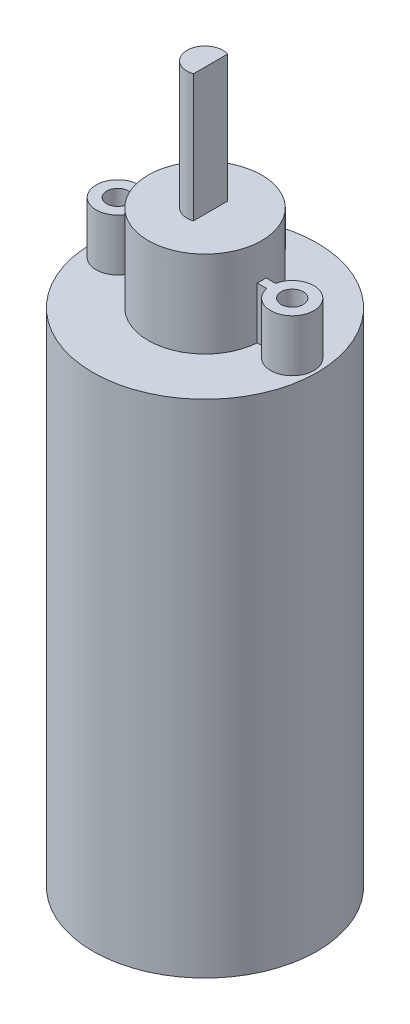
from build123d import *

# Parameters (mm, degrees)
SKETCH1_R           = 10.287
BOSS_EXTRUDE1_DEPTH = 45.974
SKETCH2_R           = 5.207
BOSS_EXTRUDE2_DEPTH = 7.9375
SKETCH3_R           = 1.651
BOSS_EXTRUDE3_DEPTH = 11.684
SKETCH4_R           = 1.984375
SKETCH4_R_2         = 1.016
SKETCH4_W           = 12.957418184
SKETCH4_H           = 0.81
BOSS_EXTRUDE5_DEPTH = 4.7625
CUT_EXTRUDE1_DEPTH  = 11.684


with BuildPart() as part:
    # Sketch1 → Boss-Extrude1 (new body)
    with BuildSketch(Plane(origin=(0, 0, 0), x_dir=(1, 0, 0), z_dir=(0, 1, 0))):
        with Locations(Location((0, 0, 0), (0, 0, 270))):
            Circle(SKETCH1_R)
    extrude(amount=BOSS_EXTRUDE1_DEPTH)

    # Sketch2 → Boss-Extrude2 (add)
    with BuildSketch(Plane(origin=(0, 45.974, 0), x_dir=(1, 0, 0), z_dir=(0, 1, 0))):
        with Locations(Location((0, 0, 0), (0, 0, 270))):
            Circle(SKETCH2_R)
    extrude(amount=BOSS_EXTRUDE2_DEPTH)

    # Sketch3 → Boss-Extrude3 (add)
    with BuildSketch(Plane(origin=(0, 53.9115, 0), x_dir=(1, 0, 0), z_dir=(0, 1, 0))):
        with Locations(Location((0, 0, 0), (0, 0, 270))):
            Circle(SKETCH3_R)
    extrude(amount=BOSS_EXTRUDE3_DEPTH)

    # Sketch4 → Boss-Extrude5 (add)
    # profile 1 of 3: a face of its own
    with BuildSketch(Plane(origin=(0, 45.974, 0), x_dir=(1, 0, 0), z_dir=(0, 1, 0))):
        with Locations((-8.001, 0)):
            Circle(SKETCH4_R)
        with Locations(Location((-8.001, 0, 0), (0, 0, 90))):
            Circle(SKETCH4_R_2, mode=Mode.SUBTRACT)
    # profile 2 of 3: a face of its own
    with BuildSketch(Plane(origin=(0, 45.974, 0), x_dir=(1, 0, 0), z_dir=(0, 1, 0))):
        with Locations((8.001, 0)):
            Circle(SKETCH4_R)
        with Locations(Location((8.001, 0, 0), (0, 0, 90))):
            Circle(SKETCH4_R_2, mode=Mode.SUBTRACT)
    # profile 3 of 3: a face of its own
    with BuildSketch(Plane(origin=(0, 45.974, 0), x_dir=(1, 0, 0), z_dir=(0, 1, 0))):
        with Locations((0.016128597, 0)):
            Rectangle(SKETCH4_W, SKETCH4_H)
    extrude(amount=BOSS_EXTRUDE5_DEPTH)

    # Sketch5 → Cut-Extrude1 (cut)
    with BuildSketch(Plane(origin=(0, 65.5955, 0), x_dir=(1, 0, 0), z_dir=(0, 1, 0))):
        Polygon((0.508, 43.642192231), (0.508, 1.570903243), (0.508, -1.570903243), (0.508, -43.642192231), (84.650577975, -43.642192231), (84.650577975, 43.642192231), align=None)
    extrude(amount=-CUT_EXTRUDE1_DEPTH, mode=Mode.SUBTRACT)


solid = part.part
